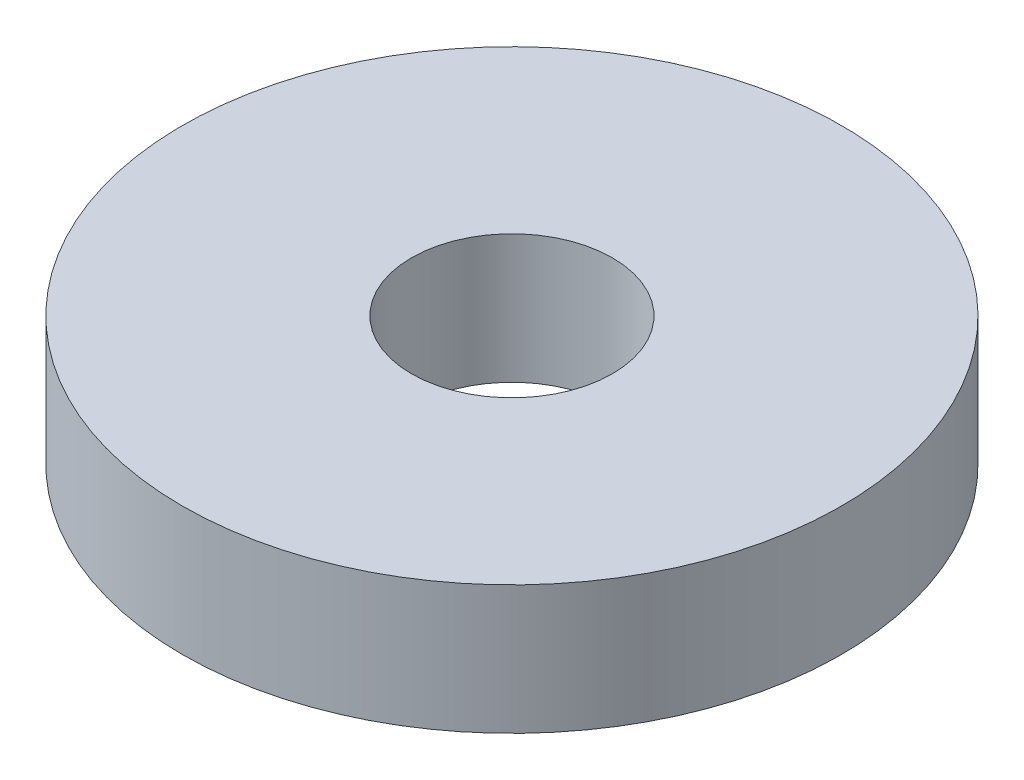
from build123d import *

# Parameters (mm, degrees)
SKETCH1_R           = 2.05
SKETCH1_R_2         = 0.625
BOSS_EXTRUDE1_DEPTH = 0.8


with BuildPart() as part:
    # Sketch1 → Boss-Extrude1 (new body)
    with BuildSketch(Plane(origin=(0, 0, 0), x_dir=(1, 0, 0), z_dir=(0, 1, 0))):
        with Locations(Location((0, 0, 0), (0, 0, 270))):
            Circle(SKETCH1_R)
        with Locations(Location((0, 0, 0), (0, 0, 270))):
            Circle(SKETCH1_R_2, mode=Mode.SUBTRACT)
    extrude(amount=BOSS_EXTRUDE1_DEPTH)


solid = part.part
